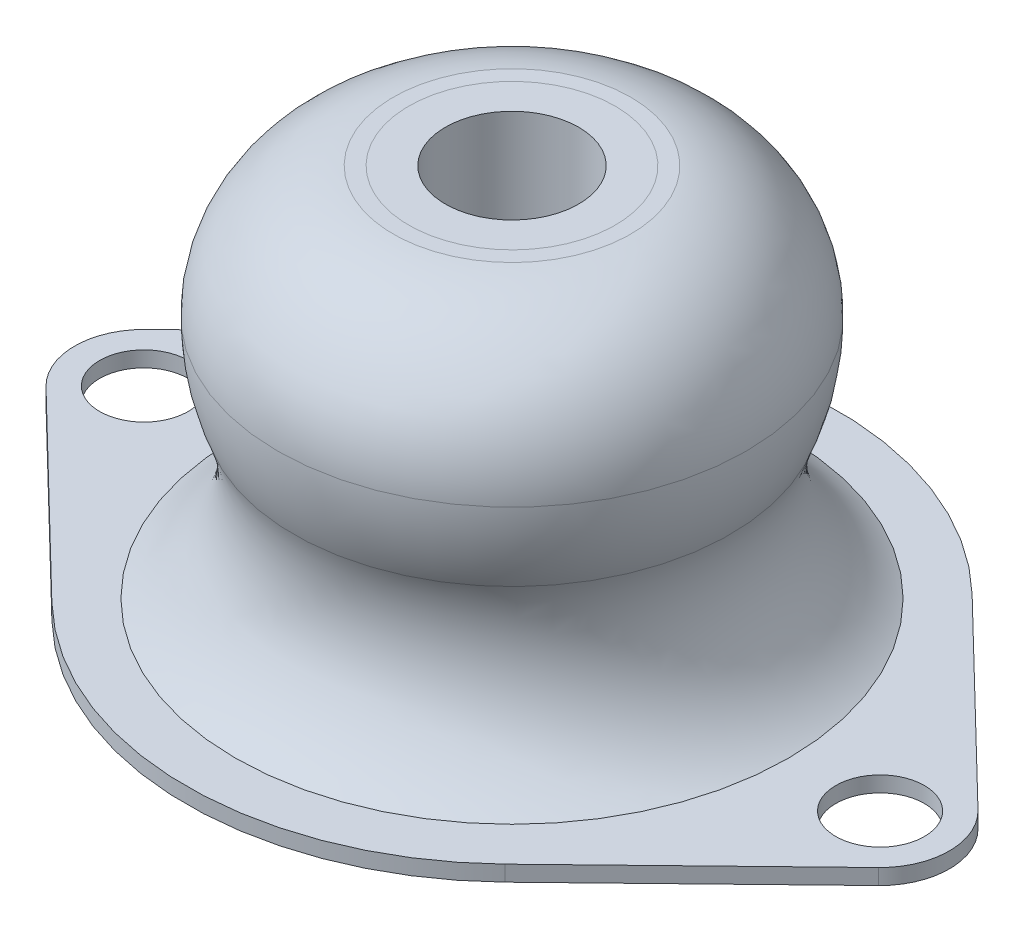
from build123d import *

# Parameters (mm, degrees)
SKETCH3_W           = 1.78394955
SKETCH3_H           = 6.35
BOSS_EXTRUDE1_START = 9.525
SKETCH4_R           = 2.159
SKETCH4_R_2         = 9.525
BOSS_EXTRUDE1_DEPTH = 0.762


with BuildPart() as part:
    # Sketch2 → Revolve1 (revolve)
    with BuildSketch(Plane.XY, mode=Mode.PRIVATE) as revolve1_sk:
        with BuildLine():
            Line((-13.49375, -8.763), (-9.525, -8.763))
            ThreePointArc((-9.525, -8.763), (-8.291277851, -4.142846868), (-8.82137527, 0.60971897))
            ThreePointArc((-8.82137527, 0.60971897), (-8.519312402, 2.370669223), (-6.923931641, 3.175))
            Line((-6.923931641, 3.175), (-5.03514955, 3.175))
            Line((-5.03514955, 3.175), (-5.03514955, 9.525))
            Line((-5.03514955, 9.525), (-5.7912, 9.525))
            ThreePointArc((-5.7912, 9.525), (-9.816830313, 7.421132518), (-11.43, 3.175))
            ThreePointArc((-11.43, 3.175), (-11.232702601, 1.182489718), (-10.648473168, -0.732634158))
            ThreePointArc((-10.648473168, -0.732634158), (-10.524604723, -5.295767226), (-13.49375, -8.763))
        make_face()
    revolve(revolve1_sk.sketch.rotate(Axis((0, -9.525, 0), (0, 1, 0)), 270), axis=Axis((0, -9.525, 0), (0, 1, 0)))


with BuildPart() as body_2:
    # Sketch3 → Revolve2 (revolve)
    with BuildSketch(Plane.XY, mode=Mode.PRIVATE) as revolve2_sk:
        with Locations((-4.143174775, 6.35)):
            Rectangle(SKETCH3_W, SKETCH3_H)
    revolve(revolve2_sk.sketch.rotate(Axis((0, -9.525, 0), (0, 1, 0)), 270), axis=Axis((0, -9.525, 0), (0, 1, 0)))


with BuildPart() as body_3:
    # Sketch4 → Boss-Extrude1 (new body)
    with BuildSketch(Plane.XZ.offset(BOSS_EXTRUDE1_START)):
        with BuildLine():
            Line((-20.308683168, -2.42602217), (-11.04738331, -11.400480122))
            ThreePointArc((-11.04738331, -11.400480122), (0, -15.875), (11.04738331, -11.400480122))
            Line((11.04738331, -11.400480122), (20.308683168, -2.42602217))
            ThreePointArc((20.308683168, -2.42602217), (21.336, 0), (20.308683168, 2.42602217))
            Line((20.308683168, 2.42602217), (11.04738331, 11.400480122))
            ThreePointArc((11.04738331, 11.400480122), (0, 15.875), (-11.04738331, 11.400480122))
            Line((-11.04738331, 11.400480122), (-20.308683168, 2.42602217))
            ThreePointArc((-20.308683168, 2.42602217), (-21.336, 0), (-20.308683168, -2.42602217))
        make_face()
        with Locations(Location((-17.9578, 0, 0), (0, 0, 270))):
            Circle(SKETCH4_R, mode=Mode.SUBTRACT)
        with Locations(Location((17.9578, 0, 0), (0, 0, 270))):
            Circle(SKETCH4_R, mode=Mode.SUBTRACT)
        with Locations(Location((0, 0, 0), (0, 0, 270))):
            Circle(SKETCH4_R_2, mode=Mode.SUBTRACT)
    extrude(amount=-BOSS_EXTRUDE1_DEPTH)


solid = Compound([part.part, body_2.part, body_3.part])
